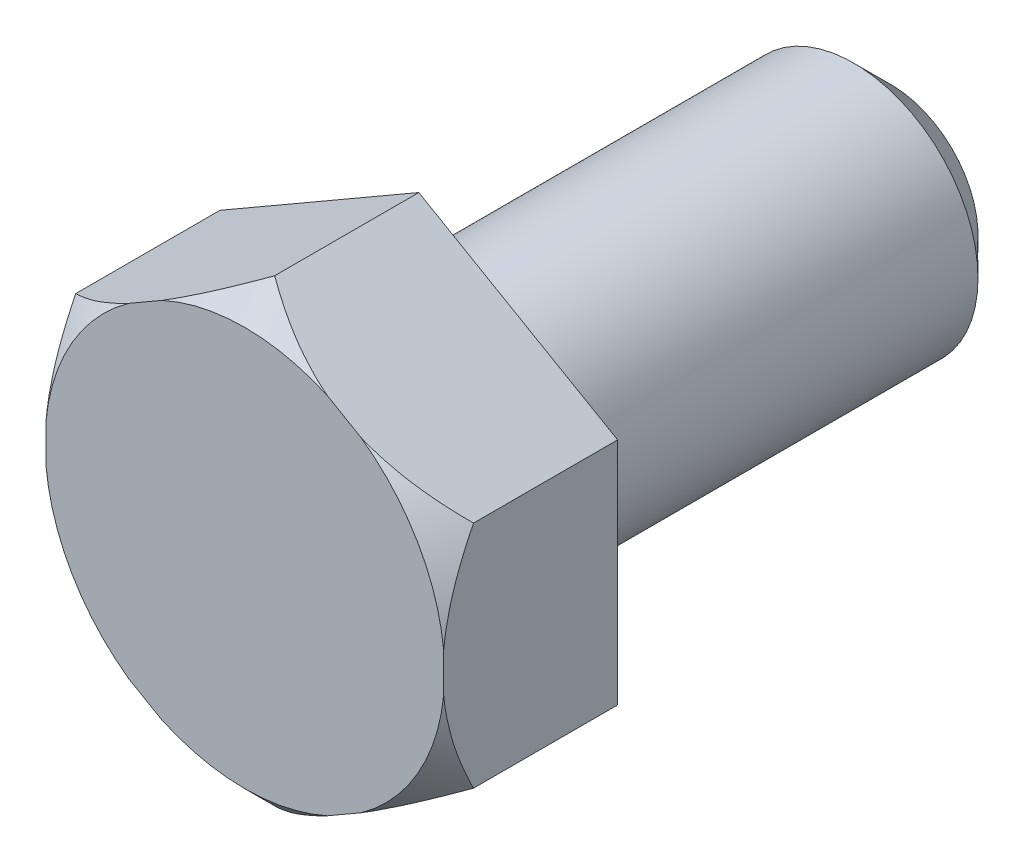
from build123d import *

# Parameters (mm, degrees)
EXTRUDE_1_DEPTH = 3.5
SKETCH_2_R      = 2.5
EXTRUDE_2_DEPTH = 9.5
CHAMFER_1_SIZE  = 0.75


with BuildPart() as part:
    # Эскиз1 → Вытянуть1 (new body)
    with BuildSketch(Plane.XY):
        Polygon((0, 4.618802154), (-4, 2.309401077), (-4, -2.309401077), (0, -4.618802154), (4, -2.309401077), (4, 2.309401077), align=None)
    extrude(amount=EXTRUDE_1_DEPTH)

    # Эскиз2 → Вытянуть2 (add)
    with BuildSketch(Plane(origin=(0, 0, 0), x_dir=(-1, 0, 0), z_dir=(0, 0, -1))):
        with Locations(Location((0, 0, 0), (0, 0, 180))):
            Circle(SKETCH_2_R)
    extrude(amount=EXTRUDE_2_DEPTH)

    # Эскиз15 → Вырез-Повернуть1 (revolve, cut)
    with BuildSketch(Plane(origin=(0, 0, 0), x_dir=(0, 0, -1), z_dir=(1, 0, 0))):
        Polygon((-3.5, 4.618802154), (-3.5, 4.018802154), (-2.9, 4.618802154), align=None)
    revolve(axis=Axis((0, 0, 2.965296569), (0, 0, -1)), mode=Mode.SUBTRACT)

    # Фаска1
    chamfer_1_edges = [part.edges().sort_by_distance(p)[0] for p in [
        (-2.5, 0, -9.5),
    ]]
    chamfer(chamfer_1_edges, length=CHAMFER_1_SIZE)


solid = part.part
